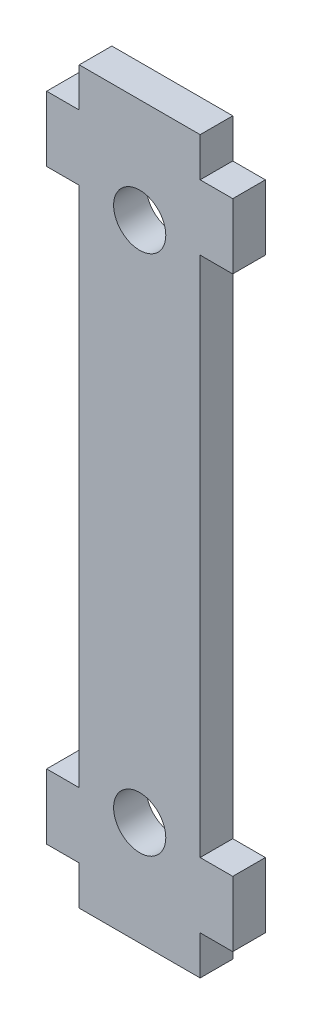
from build123d import *

# Parameters (mm, degrees)
BOSS_EXTRUDE1_DEPTH = 2.5
SKETCH3_R           = 4
CUT_EXTRUDE2_DEPTH  = 5


with BuildPart() as part:
    # Sketch1 → Boss-Extrude1 (new, symmetric)
    with BuildSketch(Plane(origin=(0, 0, 0), x_dir=(0, 1, 0), z_dir=(0, 0, 1))):
        Polygon((-56, 9.27), (-56, -9.27), (-50, -9.27), (-50, -12.741071429), (-50, -14.27), (-40, -14.27), (-40, -10.192857143), (-40, -9.27), (40, -9.27), (40, -10.192857143), (40, -14.27), (50, -14.27), (50, -9.27), (56, -9.27), (56, 9.27), (50, 9.27), (50, 14.27), (40, 14.27), (40, 9.27), (-40, 9.27), (-40, 10.192857143), (-40, 14.27), (-50, 14.27), (-50, 12.741071429), (-50, 9.27), align=None)
    extrude(amount=BOSS_EXTRUDE1_DEPTH, both=True)

    # Sketch3 → Cut-Extrude2 (cut)
    with BuildSketch(Plane.XY.offset(2.5)):
        with Locations((0, 40)):
            Circle(SKETCH3_R)
        with Locations((0, -40)):
            Circle(SKETCH3_R)
    extrude(amount=-CUT_EXTRUDE2_DEPTH, mode=Mode.SUBTRACT)


solid = part.part
